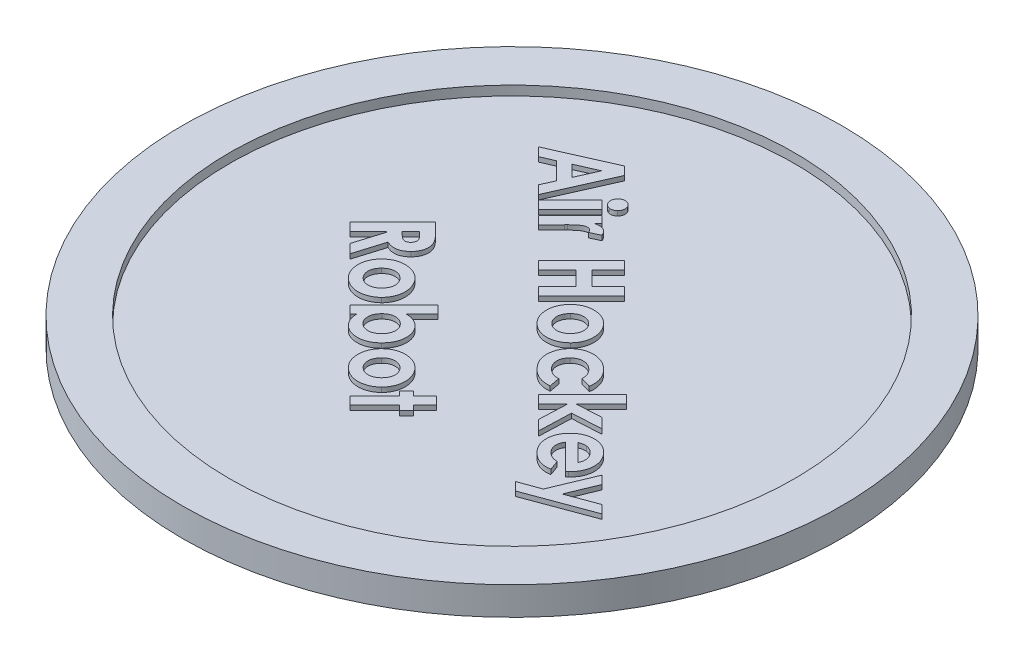
from build123d import *

# Parameters (mm, degrees)
SKETCH_1_R          = 35
EXTRUDE_1_DEPTH     = 3
SKETCH_2_R          = 30
CUT_EXTRUDE_1_DEPTH = 1
EXTRUDE_2_DEPTH     = 0.5


with BuildPart() as part:
    # 草圖1 → 填料-伸長1 (new body)
    with BuildSketch(Plane(origin=(0, 0, 0), x_dir=(1, 0, 0), z_dir=(0, 1, 0))):
        with Locations(Location((0, 0, 0), (0, 0, 270))):
            Circle(SKETCH_1_R)
    extrude(amount=EXTRUDE_1_DEPTH)

    # 草圖2 → 除料-伸長1 (cut)
    with BuildSketch(Plane(origin=(0, 3, 0), x_dir=(1, 0, 0), z_dir=(0, 1, 0))):
        with Locations(Location((0, 0, 0), (0, 0, 270))):
            Circle(SKETCH_2_R)
    extrude(amount=-CUT_EXTRUDE_1_DEPTH, mode=Mode.SUBTRACT)

    # 草圖3 → 填料-伸長2 (add)
    # profile 1 of 15: a face of its own
    with BuildSketch(Plane(origin=(0, 2, 0), x_dir=(1, 0, 0), z_dir=(0, 1, 0))):
        Polygon((-8.308132153, 20.235517611), (-7.429225903, 19.356611361), (-10.228705069, 13.057132194), (-11.128444653, 13.956871777), (-10.546413403, 15.249840527), (-12.401882153, 17.105309277), (-13.710475903, 16.538903027), (-14.611517569, 17.439944694), align=None)
        Polygon((-9.069850903, 18.583173861), (-11.236517569, 17.627444694), (-10.028184236, 16.419111361), align=None, mode=Mode.SUBTRACT)
    # profile 2 of 15: a face of its own
    with BuildSketch(Plane(origin=(0, 2, 0), x_dir=(1, 0, 0), z_dir=(0, 1, 0))):
        with BuildLine():
            add(Edge.make_bspline(
                [(-4.540701528, 16.869128653), (-4.506302538, 16.831415875), (-4.438672262, 16.757270513), (-4.369666269, 16.623185376), (-4.3265856, 16.478719339), (-4.315458453, 16.325713882), (-4.327339772, 16.172301179), (-4.374316337, 16.027041873), (-4.445159914, 15.891071744), (-4.514529993, 15.815249065), (-4.549816111, 15.776680736)],
                knots=[0, 0, 0, 0, 1.005724699, 1.977309142, 2.95252767, 3.969148236, 4.995077585, 5.975270981, 6.970091596, 8, 8, 8, 8], degree=3))
            add(Edge.make_bspline(
                [(-4.549816111, 15.776680736), (-4.587983789, 15.741892176), (-4.66273734, 15.673756816), (-4.79657428, 15.603315447), (-4.940445468, 15.558559849), (-5.092355459, 15.545966332), (-5.243766105, 15.557915221), (-5.387317456, 15.598335129), (-5.518106038, 15.668851651), (-5.591796798, 15.734305428), (-5.629243195, 15.767566153)],
                knots=[0, 0, 0, 0, 1.031019004, 2.019308924, 3.001342932, 4.031921768, 5.053065166, 6.030158479, 6.999013346, 8, 8, 8, 8], degree=3))
            add(Edge.make_bspline(
                [(-5.629243195, 15.767566153), (-5.663901005, 15.806231646), (-5.731566126, 15.881721276), (-5.803929615, 16.015803847), (-5.843927233, 16.162228711), (-5.856431857, 16.315785833), (-5.842050627, 16.47047963), (-5.794973901, 16.616934808), (-5.721684858, 16.753643585), (-5.651867743, 16.830095732), (-5.616222361, 16.869128653)],
                knots=[0, 0, 0, 0, 1.015137644, 1.981931666, 2.954137343, 3.970023233, 4.987475091, 5.977566914, 6.96743944, 8, 8, 8, 8], degree=3))
            add(Edge.make_bspline(
                [(-5.616222361, 16.869128653), (-5.578485152, 16.903476903), (-5.504576056, 16.970748653), (-5.372018276, 17.040034704), (-5.229299597, 17.082926609), (-5.078461945, 17.096326776), (-4.927624292, 17.082926609), (-4.784905613, 17.040034704), (-4.652347833, 16.970748653), (-4.578438738, 16.903476903), (-4.540701528, 16.869128653)],
                knots=[0, 0, 0, 0, 1.021734464, 2.001087806, 2.975106579, 4, 5.024893421, 5.998912194, 6.978265536, 8, 8, 8, 8], degree=3))
        make_face()
    # profile 3 of 15: a face of its own
    with BuildSketch(Plane(origin=(0, 2, 0), x_dir=(1, 0, 0), z_dir=(0, 1, 0))):
        Polygon((-6.349295278, 15.906889069), (-5.502941111, 15.060534903), (-8.867524445, 11.695951569), (-9.713878611, 12.542305736), align=None)
    # profile 4 of 15: a face of its own
    with BuildSketch(Plane(origin=(0, 2, 0), x_dir=(1, 0, 0), z_dir=(0, 1, 0))):
        with BuildLine():
            Line((-4.922699335, 14.480293127), (-4.198741002, 13.756334793))
            Line((-4.198741002, 13.756334793), (-4.621918085, 13.33315771))
            add(Edge.make_bspline(
                [(-4.621918085, 13.33315771), (-4.562041953, 13.353161022), (-4.445764116, 13.392006914), (-4.268354232, 13.419439503), (-4.096583131, 13.426602959), (-3.93085699, 13.404654332), (-3.773544276, 13.362150083), (-3.626338129, 13.298766809), (-3.490576, 13.214371651), (-3.412501635, 13.141804005), (-3.373220169, 13.105293127)],
                knots=[0, 0, 0, 0, 1.126146671, 2.186946502, 3.195634824, 4.188365352, 5.161051018, 6.09895006, 7.043526897, 8, 8, 8, 8], degree=3))
            add(Edge.make_bspline(
                [(-3.373220169, 13.105293127), (-3.346242255, 13.076520363), (-3.291376697, 13.01800458), (-3.225050678, 12.914161811), (-3.163336392, 12.800420587), (-3.132606793, 12.717302305), (-3.116709752, 12.674303543)],
                knots=[0, 0, 0, 0, 0.934144126, 1.899788824, 2.913518474, 4, 4, 4, 4], degree=3))
            Line((-3.116709752, 12.674303543), (-4.106293085, 12.210761877))
            add(Edge.make_bspline(
                [(-4.106293085, 12.210761877), (-4.11892839, 12.245200475), (-4.142737929, 12.310095402), (-4.181990177, 12.399089101), (-4.225842137, 12.472274938), (-4.260683368, 12.511536539), (-4.276866002, 12.529772293)],
                knots=[0, 0, 0, 0, 1.207300046, 2.274995243, 3.198790619, 4, 4, 4, 4], degree=3))
            add(Edge.make_bspline(
                [(-4.276866002, 12.529772293), (-4.293238863, 12.545250309), (-4.325784589, 12.576017275), (-4.384533726, 12.609389694), (-4.447987721, 12.63479308), (-4.517473699, 12.650046414), (-4.592275877, 12.656297153), (-4.672759094, 12.653731141), (-4.75848589, 12.639701526), (-4.851493603, 12.617938112), (-4.952181234, 12.580278882), (-5.061564598, 12.524401745), (-5.181760152, 12.450936445), (-5.311374534, 12.357593758), (-5.45189197, 12.247039654), (-5.601914247, 12.116794675), (-5.762975202, 11.969138416), (-5.871417524, 11.861753353), (-5.927907669, 11.80581396)],
                knots=[0, 0, 0, 0, 0.547554116, 1.088419826, 1.634745323, 2.209833694, 2.815372807, 3.461273872, 4.167714151, 4.930047112, 5.787193072, 6.781080403, 7.920888814, 9.218788771, 10.673267404, 12.279143793, 14.061718902, 16, 16, 16, 16], degree=3))
            Line((-5.927907669, 11.80581396), (-6.089366002, 11.639147293))
            Line((-6.089366002, 11.639147293), (-7.450043085, 10.27847021))
            Line((-7.450043085, 10.27847021), (-8.287282669, 11.115709793))
            Line((-8.287282669, 11.115709793), (-4.922699335, 14.480293127))
        make_face()
    # profile 5 of 15: a face of its own
    with BuildSketch(Plane(origin=(0, 2, 0), x_dir=(1, 0, 0), z_dir=(0, 1, 0))):
        Polygon((0.380118646, 11.547266812), (1.257722813, 10.669662645), (-0.458423021, 8.953516812), (1.063712396, 7.431381395), (2.779858229, 9.147527229), (3.654858229, 8.272527229), (-0.894620937, 3.723048062), (-1.769620937, 4.598048062), (0.225170729, 6.592839729), (-1.296964687, 8.114975145), (-3.291756354, 6.120183479), (-4.169360521, 6.997787645), align=None)
    # profile 6 of 15: a face of its own
    with BuildSketch(Plane(origin=(0, 2, 0), x_dir=(1, 0, 0), z_dir=(0, 1, 0))):
        with BuildLine():
            add(Edge.make_bspline(
                [(5.073611982, 4.658460976), (5.112359931, 4.618159198), (5.189367823, 4.538063218), (5.294508512, 4.409739231), (5.391961361, 4.277098353), (5.477066541, 4.136733679), (5.556146486, 3.992806723), (5.623377751, 3.841629117), (5.683963423, 3.686050946), (5.73241364, 3.524653673), (5.773370585, 3.361510632), (5.801948919, 3.197437219), (5.818788173, 3.033828332), (5.825283364, 2.870747878), (5.821742897, 2.708025391), (5.806012455, 2.545691545), (5.778113631, 2.384047665), (5.740998025, 2.22338796), (5.692320164, 2.065761129), (5.635499097, 1.912492212), (5.569081339, 1.764243092), (5.491093454, 1.622639845), (5.407556423, 1.483884891), (5.311537007, 1.352058224), (5.206222312, 1.225898514), (5.130065998, 1.146320123), (5.091841148, 1.106377643)],
                knots=[0, 0, 0, 0, 1.019077246, 2.025319838, 3.022652611, 4.017627434, 5.016246866, 6.01511716, 7.032225648, 8.058652104, 9.085597134, 10.097890734, 11.092519255, 12.082603187, 13.072180877, 14.058144064, 15.053496535, 16.061356281, 17.062763015, 18.059467547, 19.040654524, 20.021586116, 21.005673426, 21.991954205, 22.99210918, 24, 24, 24, 24], degree=3))
            add(Edge.make_bspline(
                [(5.091841148, 1.106377643), (5.052095312, 1.067491064), (4.973078049, 0.990182057), (4.843973057, 0.886869464), (4.711993138, 0.789725272), (4.57311717, 0.703957948), (4.429407862, 0.626502177), (4.279574246, 0.559075051), (4.124331148, 0.500368571), (3.964780714, 0.451093265), (3.802646164, 0.411789969), (3.639814028, 0.385014622), (3.477670334, 0.367117051), (3.315822841, 0.363132637), (3.153908594, 0.365504356), (2.992182562, 0.383603654), (2.830851313, 0.41075414), (2.670493894, 0.448068206), (2.513417476, 0.498093851), (2.359887991, 0.556565673), (2.210258193, 0.623697917), (2.067787586, 0.704681604), (1.92696431, 0.790810365), (1.793572213, 0.891146661), (1.662713406, 0.998382837), (1.580913211, 1.07715991), (1.539757815, 1.11679431)],
                knots=[0, 0, 0, 0, 1.011697538, 2.011319398, 3.007061161, 3.993732213, 4.98005516, 5.977331991, 6.982621712, 7.999858455, 9.01562103, 10.017177301, 11.002360137, 11.982682706, 12.962782332, 13.947965168, 14.941729788, 15.940289251, 16.942437578, 17.940340289, 18.930422597, 19.924312866, 20.921871392, 21.933322039, 22.960210896, 24, 24, 24, 24], degree=3))
            add(Edge.make_bspline(
                [(1.539757815, 1.11679431), (1.482080223, 1.177783262), (1.368354103, 1.298038574), (1.221395342, 1.494996848), (1.0947087, 1.699356046), (0.994606542, 1.91547809), (0.914175308, 2.139614702), (0.858732018, 2.374215261), (0.824364155, 2.617435361), (0.81504093, 2.86726372), (0.82569953, 3.117055252), (0.860990437, 3.361382417), (0.920015867, 3.596307704), (1.000313968, 3.822834239), (1.106157376, 4.038956102), (1.232778725, 4.246870574), (1.382831239, 4.446293044), (1.498986309, 4.56799629), (1.557986982, 4.629815143)],
                knots=[0, 0, 0, 0, 1.029931388, 2.030773055, 3.011491503, 3.977033508, 4.949609453, 5.930689829, 6.931574062, 7.961008964, 8.996001876, 9.997637795, 10.986431696, 11.965817094, 12.943054205, 13.935646626, 14.951416964, 16, 16, 16, 16], degree=3))
            add(Edge.make_bspline(
                [(1.557986982, 4.629815143), (1.624003516, 4.692476072), (1.753977642, 4.815843642), (1.967888137, 4.973176541), (2.190334291, 5.106191952), (2.422950558, 5.212440052), (2.666164783, 5.290488248), (2.918579084, 5.34449163), (3.18156384, 5.37097779), (3.359594457, 5.367338523), (3.449914065, 5.365492226)],
                knots=[0, 0, 0, 0, 1.042716123, 2.052911692, 3.036918457, 4.01009467, 4.977912503, 5.959765238, 6.964935325, 8, 8, 8, 8], degree=3))
            add(Edge.make_bspline(
                [(3.449914065, 5.365492226), (3.529064158, 5.35948099), (3.68474366, 5.34765755), (3.912727535, 5.306624485), (4.131220448, 5.246855735), (4.339895992, 5.167080842), (4.539423958, 5.069032083), (4.728239136, 4.951174762), (4.908622074, 4.815537342), (5.018170914, 4.71124288), (5.073611982, 4.658460976)],
                knots=[0, 0, 0, 0, 1.050238507, 2.065703277, 3.060941432, 4.044770367, 5.018616752, 5.999151908, 6.98740001, 8, 8, 8, 8], degree=3))
        make_face()
        with BuildLine():
            add(Edge.make_bspline(
                [(4.291059898, 3.849867226), (4.258276635, 3.881416242), (4.19375478, 3.943508932), (4.087545005, 4.022623085), (3.977875265, 4.089777852), (3.863337117, 4.143484583), (3.744812416, 4.185441519), (3.621250564, 4.214277124), (3.493338488, 4.229818373), (3.362525112, 4.231870626), (3.231281555, 4.223173822), (3.101824449, 4.201505192), (2.97659955, 4.16411302), (2.854310656, 4.115840613), (2.735399317, 4.054060733), (2.619425618, 3.979647878), (2.506724952, 3.892264855), (2.437170955, 3.82535858), (2.401736982, 3.791273476)],
                knots=[0, 0, 0, 0, 1.03096956, 2.029086276, 2.996391749, 3.943093968, 4.892606537, 5.842884122, 6.814736472, 7.809108808, 8.805671127, 9.794424805, 10.778758902, 11.763978501, 12.772140384, 13.812465576, 14.885570338, 16, 16, 16, 16], degree=3))
            add(Edge.make_bspline(
                [(2.401736982, 3.791273476), (2.366758819, 3.75498775), (2.2980737, 3.683735024), (2.208701658, 3.568500377), (2.130816157, 3.451577481), (2.068594178, 3.33051563), (2.016685119, 3.208264475), (1.980273563, 3.081861315), (1.956743898, 2.952717454), (1.946647141, 2.821865685), (1.948427656, 2.69172377), (1.966345357, 2.564973489), (1.994093926, 2.44197784), (2.03724421, 2.323904532), (2.08961754, 2.208509356), (2.158499477, 2.09946641), (2.238491164, 1.993795755), (2.299962292, 1.928738028), (2.331424482, 1.895440143)],
                knots=[0, 0, 0, 0, 1.135685708, 2.230097347, 3.283299858, 4.29886171, 5.294853694, 6.273529507, 7.258303048, 8.249861526, 9.228733054, 10.186536227, 11.131351297, 12.066178827, 13.016301177, 13.983161557, 14.967740556, 16, 16, 16, 16], degree=3))
            add(Edge.make_bspline(
                [(2.331424482, 1.895440143), (2.364667981, 1.863906941), (2.429870653, 1.802058789), (2.536623879, 1.722905559), (2.645777921, 1.653651454), (2.761851931, 1.600653432), (2.881180245, 1.558628699), (3.00524883, 1.530120333), (3.133361499, 1.512466821), (3.26524397, 1.510532515), (3.397231826, 1.521113186), (3.527534831, 1.542637188), (3.654332909, 1.579796141), (3.777880247, 1.629582808), (3.898997312, 1.69061114), (4.014879494, 1.767519839), (4.128834896, 1.855567119), (4.199219833, 1.923393075), (4.235070315, 1.957940143)],
                knots=[0, 0, 0, 0, 1.030150722, 2.020502673, 2.98538793, 3.93356935, 4.884914481, 5.827799461, 6.793327102, 7.789728672, 8.788998142, 9.770059894, 10.756116334, 11.755433532, 12.764440154, 13.801972256, 14.88043724, 16, 16, 16, 16], degree=3))
            add(Edge.make_bspline(
                [(4.235070315, 1.957940143), (4.26960586, 1.993797132), (4.337409192, 2.064194843), (4.425619317, 2.178058298), (4.501840094, 2.294116406), (4.564537848, 2.413152356), (4.615248305, 2.534860923), (4.649374035, 2.66066252), (4.67414721, 2.788575462), (4.681863542, 2.918741677), (4.680702312, 3.048367141), (4.662576887, 3.175117154), (4.634934811, 3.298704798), (4.590712734, 3.417246316), (4.536522072, 3.532552297), (4.467435051, 3.643091638), (4.385572082, 3.749675014), (4.322909692, 3.816103312), (4.291059898, 3.849867226)],
                knots=[0, 0, 0, 0, 1.123779765, 2.206306951, 3.247747078, 4.256370284, 5.241273741, 6.218929401, 7.1957491, 8.17850339, 9.159054796, 10.118501691, 11.064938192, 12.013910021, 12.969844468, 13.938364113, 14.952119812, 16, 16, 16, 16], degree=3))
        make_face(mode=Mode.SUBTRACT)
    # profile 7 of 15: a face of its own
    with BuildSketch(Plane(origin=(0, 2, 0), x_dir=(1, 0, 0), z_dir=(0, 1, 0))):
        with BuildLine():
            Line((10.086090557, -1.887871765), (8.99754889, -1.572767599))
            add(Edge.make_bspline(
                [(8.99754889, -1.572767599), (8.997882731, -1.508053506), (8.998525096, -1.383532706), (8.980202627, -1.204693618), (8.947324502, -1.041925042), (8.896393493, -0.89405258), (8.829747288, -0.754929925), (8.743615025, -0.621383454), (8.642516409, -0.486972344), (8.562319225, -0.404391466), (8.52098639, -0.361830099)],
                knots=[0, 0, 0, 0, 1.15413121, 2.220742607, 3.202025827, 4.110720337, 5.004471644, 5.947791409, 6.942312015, 8, 8, 8, 8], degree=3))
            add(Edge.make_bspline(
                [(8.52098639, -0.361830099), (8.481625787, -0.324300333), (8.404230227, -0.250504788), (8.280772745, -0.152919089), (8.153770302, -0.070365769), (8.024060273, -0.001968455), (7.890817462, 0.052323236), (7.753278778, 0.089136795), (7.613558802, 0.115219875), (7.471620628, 0.12292764), (7.330613798, 0.120550845), (7.192522585, 0.099652273), (7.058243292, 0.067973862), (6.928272338, 0.02031417), (6.802592877, -0.041227199), (6.681700673, -0.117188025), (6.563936883, -0.206466437), (6.491679647, -0.275569044), (6.45458014, -0.311048849)],
                knots=[0, 0, 0, 0, 1.123577633, 2.209313703, 3.246844627, 4.249951721, 5.236069482, 6.213211358, 7.188044763, 8.167818233, 9.145947786, 10.097388463, 11.04815232, 11.993101052, 12.951913267, 13.935089094, 14.939799237, 16, 16, 16, 16], degree=3))
            add(Edge.make_bspline(
                [(6.45458014, -0.311048849), (6.420512388, -0.346934438), (6.353615447, -0.417400963), (6.266068281, -0.531012804), (6.192799165, -0.64900427), (6.132221663, -0.770347562), (6.08629311, -0.896129268), (6.055173683, -1.025958106), (6.036977448, -1.159426793), (6.031578367, -1.295521035), (6.040702855, -1.43213837), (6.064069375, -1.566631838), (6.102233079, -1.698005949), (6.154996255, -1.825873465), (6.220314315, -1.95167835), (6.300052489, -2.074228654), (6.394396641, -2.193109641), (6.465272882, -2.267741181), (6.50145514, -2.305840515)],
                knots=[0, 0, 0, 0, 1.058346643, 2.078216131, 3.062709567, 4.026347698, 4.975373472, 5.921486162, 6.877710718, 7.853623855, 8.830994338, 9.80212269, 10.769156441, 11.752246964, 12.757549182, 13.798307538, 14.876037951, 16, 16, 16, 16], degree=3))
            add(Edge.make_bspline(
                [(6.50145514, -2.305840515), (6.548338499, -2.350659093), (6.640053688, -2.43833507), (6.789049096, -2.550398146), (6.942298544, -2.642409825), (7.09943043, -2.714734087), (7.261060264, -2.767469979), (7.427114983, -2.80021734), (7.597800493, -2.81246545), (7.711981701, -2.804604693), (7.769684307, -2.800632182)],
                knots=[0, 0, 0, 0, 1.103422607, 2.158561471, 3.165974868, 4.141337476, 5.097022321, 6.053420992, 7.016276989, 8, 8, 8, 8], degree=3))
            Line((7.769684307, -2.800632182), (7.980621807, -3.920423849))
            add(Edge.make_bspline(
                [(7.980621807, -3.920423849), (7.878289119, -3.930443592), (7.676801464, -3.950171938), (7.375358039, -3.933821801), (7.082409136, -3.884869377), (6.797112678, -3.799348526), (6.520477597, -3.676962903), (6.25295589, -3.51782496), (5.992470685, -3.323858196), (5.832394835, -3.171749463), (5.750153057, -3.093600932)],
                knots=[0, 0, 0, 0, 0.998027156, 1.965062747, 2.923393704, 3.878879977, 4.851492478, 5.855571275, 6.8982621, 8, 8, 8, 8], degree=3))
            add(Edge.make_bspline(
                [(5.750153057, -3.093600932), (5.679905913, -3.020046265), (5.542820732, -2.876506553), (5.362488647, -2.647585622), (5.209977616, -2.41456181), (5.088862746, -2.175470893), (4.991573832, -1.933968537), (4.926605288, -1.686288228), (4.889993054, -1.434263488), (4.881075297, -1.180166431), (4.898811034, -0.929209351), (4.936203732, -0.686020584), (4.994439078, -0.452808877), (5.076251078, -0.23035072), (5.177548106, -0.016873857), (5.302505395, 0.185266346), (5.446902078, 0.378322273), (5.558384505, 0.4955703), (5.61473639, 0.554836568)],
                knots=[0, 0, 0, 0, 1.192958301, 2.328022118, 3.414370075, 4.455309373, 5.468223845, 6.463924045, 7.452132411, 8.451005793, 9.441272533, 10.400024009, 11.335107751, 12.256709812, 13.177030354, 14.10292869, 15.041072681, 16, 16, 16, 16], degree=3))
            add(Edge.make_bspline(
                [(5.61473639, 0.554836568), (5.655831869, 0.59454137), (5.73731423, 0.673266358), (5.868613724, 0.779161055), (6.002250436, 0.87846974), (6.143955992, 0.963752083), (6.289974301, 1.040802331), (6.440478374, 1.108917058), (6.59707201, 1.164849408), (6.757502412, 1.211473857), (6.921374857, 1.24817805), (7.086736117, 1.272833739), (7.252503668, 1.28597458), (7.418710446, 1.287205223), (7.585380098, 1.276909269), (7.752240552, 1.254118517), (7.920032707, 1.222187127), (8.087085037, 1.175836774), (8.253108232, 1.1207799), (8.415457548, 1.053458615), (8.574034552, 0.977118359), (8.728674877, 0.889544276), (8.877749454, 0.789884205), (9.024579302, 0.682319753), (9.165361897, 0.561513499), (9.255341723, 0.474983311), (9.300934307, 0.431138651)],
                knots=[0, 0, 0, 0, 0.998546862, 1.979876108, 2.946722394, 3.907174954, 4.867777385, 5.83241755, 6.792570297, 7.772372729, 8.751822482, 9.72626223, 10.692959612, 11.656703965, 12.629901973, 13.609733789, 14.599389313, 15.6136704, 16.638316116, 17.655743147, 18.684091197, 19.71378225, 20.759785157, 21.817612011, 22.894188707, 24, 24, 24, 24], degree=3))
            add(Edge.make_bspline(
                [(9.300934307, 0.431138651), (9.341870541, 0.389564042), (9.422787684, 0.307385046), (9.532881242, 0.17633228), (9.635198348, 0.043390013), (9.727607841, -0.093019213), (9.80971518, -0.232891536), (9.882823861, -0.375008502), (9.947089442, -0.520110845), (10.019178397, -0.716585119), (10.087430724, -0.966387277), (10.126959672, -1.272315613), (10.1323799, -1.581171938), (10.101580003, -1.785243165), (10.086090557, -1.887871765)],
                knots=[0, 0, 0, 0, 0.823435261, 1.627654116, 2.414479976, 3.191171413, 3.952038252, 4.702945379, 5.446440362, 6.190894271, 7.656481361, 9.090733376, 10.536912984, 12, 12, 12, 12], degree=3))
        make_face()
    # profile 8 of 15: a face of its own
    with BuildSketch(Plane(origin=(0, 2, 0), x_dir=(1, 0, 0), z_dir=(0, 1, 0))):
        Polygon((12.844662882, -0.688110757), (13.688412882, -1.531860757), (11.000912882, -4.219360757), (13.632423299, -4.074829507), (14.689714965, -5.132121174), (11.627214965, -5.298787841), (11.500912882, -8.672485757), (10.452735799, -7.624308674), (10.573829549, -4.646444091), (9.024350382, -6.195923257), (8.180600382, -5.352173257), align=None)
    # profile 9 of 15: a face of its own
    with BuildSketch(Plane(origin=(0, 2, 0), x_dir=(1, 0, 0), z_dir=(0, 1, 0))):
        with BuildLine():
            Line((16.694994316, -10.991567192), (13.982754733, -8.279327608))
            add(Edge.make_bspline(
                [(13.982754733, -8.279327608), (13.959337255, -8.314217317), (13.913384904, -8.382681741), (13.852519123, -8.488452359), (13.803810828, -8.597012089), (13.768425194, -8.707903978), (13.739553823, -8.819344492), (13.724615983, -8.932970473), (13.719341415, -9.047972447), (13.724238792, -9.1640036), (13.741404892, -9.279494126), (13.768996957, -9.393155157), (13.806174398, -9.505045337), (13.858612978, -9.612744783), (13.918132648, -9.720596429), (13.989824738, -9.825429715), (14.072602034, -9.928164945), (14.134582012, -9.992465518), (14.166348483, -10.025421358)],
                knots=[0, 0, 0, 0, 1.045450187, 2.051497366, 3.032953714, 3.999500088, 4.945122935, 5.893640144, 6.84504291, 7.807234905, 8.778656626, 9.745263339, 10.715243067, 11.705690765, 12.721143425, 13.778574969, 14.861457606, 16, 16, 16, 16], degree=3))
            add(Edge.make_bspline(
                [(14.166348483, -10.025421358), (14.206004255, -10.063129831), (14.284311306, -10.137591611), (14.412936464, -10.234009841), (14.547268216, -10.316329563), (14.687585298, -10.384576211), (14.833964891, -10.438734453), (14.987517998, -10.475415048), (15.146370539, -10.501721322), (15.254781055, -10.505355354), (15.30957765, -10.507192192)],
                knots=[0, 0, 0, 0, 1.030638927, 2.035171502, 3.022842558, 3.996010081, 4.971649843, 5.957693539, 6.967706782, 8, 8, 8, 8], degree=3))
            Line((15.30957765, -10.507192192), (15.687181816, -11.554067192))
            add(Edge.make_bspline(
                [(15.687181816, -11.554067192), (15.633888457, -11.562607378), (15.528971211, -11.579420219), (15.371862869, -11.591800639), (15.217988415, -11.595992553), (15.066645495, -11.590835569), (14.917952641, -11.576387225), (14.77199795, -11.553592818), (14.629572806, -11.51892158), (14.489571634, -11.476489397), (14.352333865, -11.421782536), (14.21553321, -11.360230703), (14.081362853, -11.28635589), (13.947851871, -11.203943035), (13.81517336, -11.112023593), (13.68478655, -11.007910715), (13.554686941, -10.895606698), (13.471477358, -10.814075759), (13.429369316, -10.772817192)],
                knots=[0, 0, 0, 0, 1.037977262, 2.043438746, 3.029045694, 3.998210143, 4.954520143, 5.901709836, 6.837383455, 7.772348922, 8.713557472, 9.677564548, 10.656499443, 11.657548015, 12.695256563, 13.75936974, 14.866133574, 16, 16, 16, 16], degree=3))
            add(Edge.make_bspline(
                [(13.429369316, -10.772817192), (13.366528254, -10.707047403), (13.242961147, -10.577721415), (13.081774328, -10.369151698), (12.945327066, -10.154040313), (12.832028336, -9.933660803), (12.745694687, -9.705514341), (12.684643778, -9.47103163), (12.645788634, -9.230350508), (12.635556796, -8.985056255), (12.645866294, -8.74069035), (12.68367818, -8.501945231), (12.741248107, -8.270130777), (12.825971393, -8.046896409), (12.931659464, -7.830672932), (13.061598078, -7.622560772), (13.215605196, -7.422735286), (13.333173816, -7.29915207), (13.392910983, -7.236358858)],
                knots=[0, 0, 0, 0, 1.100745336, 2.164443293, 3.184897046, 4.181323548, 5.159218785, 6.131705848, 7.11051835, 8.104794882, 9.099071413, 10.066690958, 11.026373306, 11.985811056, 12.951688299, 13.9359163, 14.9512294, 16, 16, 16, 16], degree=3))
            add(Edge.make_bspline(
                [(13.392910983, -7.236358858), (13.457330062, -7.174746086), (13.583524803, -7.054048802), (13.789010812, -6.897542902), (13.999517048, -6.762341107), (14.218694628, -6.652181469), (14.445095591, -6.565842939), (14.679261646, -6.502502721), (14.921237162, -6.465867272), (15.167469153, -6.44947297), (15.413455618, -6.458927938), (15.653908907, -6.490980797), (15.886342809, -6.547776444), (16.111188506, -6.62675351), (16.327169736, -6.732275865), (16.534868346, -6.860844244), (16.735965263, -7.012037002), (16.858899542, -7.129576302), (16.921556816, -7.189483858)],
                knots=[0, 0, 0, 0, 1.08329914, 2.122145429, 3.135427435, 4.12213039, 5.099471087, 6.077666602, 7.066076352, 8.07095118, 9.074508194, 10.054638534, 11.016071497, 11.979342807, 12.947230691, 13.933086206, 14.946533169, 16, 16, 16, 16], degree=3))
            add(Edge.make_bspline(
                [(16.921556816, -7.189483858), (16.984924551, -7.255611818), (17.108933371, -7.385022319), (17.269747338, -7.595278953), (17.405531731, -7.811620419), (17.517630094, -8.034541309), (17.603947605, -8.264064021), (17.664155713, -8.500770367), (17.699713869, -8.743845808), (17.707957645, -8.991723395), (17.693187826, -9.240080253), (17.650750728, -9.484757461), (17.58436491, -9.724551919), (17.490958129, -9.958716676), (17.372084553, -10.187447808), (17.225501633, -10.40963827), (17.055562933, -10.627767368), (16.925413492, -10.763506465), (16.859056816, -10.832713025)],
                knots=[0, 0, 0, 0, 1.071714939, 2.097315058, 3.092797047, 4.058692489, 5.013927649, 5.958067696, 6.913208226, 7.884502939, 8.857059808, 9.821188954, 10.786616375, 11.765222125, 12.767606943, 13.799383012, 14.878015722, 16, 16, 16, 16], degree=3))
            Line((16.859056816, -10.832713025), (16.694994316, -10.991567192))
        make_face()
        with BuildLine():
            add(Edge.make_bspline(
                [(16.51270265, -9.478546358), (16.542178326, -9.41732395), (16.600476631, -9.296235546), (16.650379923, -9.09981234), (16.663820984, -8.896766777), (16.645301473, -8.689904129), (16.595251233, -8.485295984), (16.511715728, -8.289727852), (16.396541115, -8.106234601), (16.297521019, -7.99921216), (16.24707765, -7.944692192)],
                knots=[0, 0, 0, 0, 0.975106788, 1.928609598, 2.892045738, 3.888073122, 4.903613331, 5.907351708, 6.93395145, 8, 8, 8, 8], degree=3))
            add(Edge.make_bspline(
                [(16.24707765, -7.944692192), (16.217508467, -7.916496389), (16.15889048, -7.860600992), (16.06560981, -7.78523643), (15.968057612, -7.719757936), (15.867886489, -7.662016594), (15.763638395, -7.613873272), (15.655901495, -7.574984757), (15.545304906, -7.542434408), (15.469042651, -7.530249896), (15.4306714, -7.524119275)],
                knots=[0, 0, 0, 0, 1.048913515, 2.07936753, 3.07474758, 4.063177134, 5.045555794, 6.018723756, 7.003123513, 8, 8, 8, 8], degree=3))
            add(Edge.make_bspline(
                [(15.4306714, -7.524119275), (15.378588645, -7.519298034), (15.267698534, -7.509033063), (15.089635002, -7.531485456), (14.892264865, -7.577607084), (14.756651654, -7.625152512), (14.68457765, -7.650421358)],
                knots=[0, 0, 0, 0, 0.819449328, 1.744700851, 2.801381962, 4, 4, 4, 4], degree=3))
            Line((14.68457765, -7.650421358), (16.51270265, -9.478546358))
        make_face(mode=Mode.SUBTRACT)
    # profile 10 of 15: a face of its own
    with BuildSketch(Plane(origin=(0, 2, 0), x_dir=(1, 0, 0), z_dir=(0, 1, 0))):
        Polygon((18.941847892, -9.3842541), (19.805129142, -10.24753535), (18.568149975, -13.234514517), (21.644972892, -12.0873791), (22.510858308, -12.953264517), (15.806431225, -15.4389416), (14.935337475, -14.56784785), (17.108514558, -13.780087434), align=None)
    # profile 11 of 15: a face of its own
    with BuildSketch(Plane(origin=(0, 2, 0), x_dir=(1, 0, 0), z_dir=(0, 1, 0))):
        with BuildLine():
            Line((-13.165694316, 5.058387641), (-12.246423483, 4.139116808))
            add(Edge.make_bspline(
                [(-12.246423483, 4.139116808), (-12.186142326, 4.078288777), (-12.07007867, 3.961172188), (-11.908667325, 3.78611222), (-11.763637563, 3.621403335), (-11.637454347, 3.465287726), (-11.528116705, 3.318936165), (-11.437193151, 3.181610455), (-11.362870774, 3.053866461), (-11.290368005, 2.896345397), (-11.227396427, 2.701258063), (-11.18999687, 2.460829962), (-11.193619321, 2.213843162), (-11.227838041, 2.006771572), (-11.272220744, 1.841112026), (-11.316483615, 1.717990924), (-11.370309072, 1.597594519), (-11.433137561, 1.47951791), (-11.506283413, 1.364122211), (-11.588001407, 1.25030497), (-11.681432733, 1.140803447), (-11.748673745, 1.070643292), (-11.782881816, 1.034950141)],
                knots=[0, 0, 0, 0, 1.422202288, 2.738268528, 3.954141481, 5.066430475, 6.071316919, 6.98699961, 7.800638646, 8.52311233, 9.863551151, 11.190939953, 12.546221376, 13.948184307, 14.665134715, 15.392482769, 16.118543733, 16.853814389, 17.6118083, 18.386113774, 19.178954413, 20, 20, 20, 20], degree=3))
            add(Edge.make_bspline(
                [(-11.782881816, 1.034950141), (-11.820099503, 0.99875076), (-11.893151216, 0.927697801), (-12.010004092, 0.833400494), (-12.126440056, 0.747269694), (-12.247889955, 0.676289384), (-12.36912291, 0.612743887), (-12.494290654, 0.563527049), (-12.620344322, 0.524013627), (-12.748911724, 0.496500169), (-12.87923678, 0.480791934), (-13.012096946, 0.47740094), (-13.147129178, 0.48348862), (-13.284687679, 0.502231241), (-13.424073047, 0.532019822), (-13.56536787, 0.57500062), (-13.709950938, 0.625948716), (-13.804885061, 0.669193903), (-13.853194316, 0.691200141)],
                knots=[0, 0, 0, 0, 1.101479092, 2.162007974, 3.184848731, 4.17239096, 5.144818291, 6.087504516, 7.022959366, 7.946358646, 8.874297119, 9.805249426, 10.764537915, 11.740494148, 12.748833498, 13.786627476, 14.87367812, 16, 16, 16, 16], degree=3))
            Line((-13.853194316, 0.691200141), (-14.798506816, -2.407758192))
            Line((-14.798506816, -2.407758192), (-15.7451214, -1.461143609))
            Line((-15.7451214, -1.461143609), (-14.841475566, 1.489377224))
            Line((-14.841475566, 1.489377224), (-14.922204733, 1.570106391))
            Line((-14.922204733, 1.570106391), (-16.849288066, -0.356976942))
            Line((-16.849288066, -0.356976942), (-17.715173483, 0.508908474))
            Line((-17.715173483, 0.508908474), (-13.165694316, 5.058387641))
        make_face()
        with BuildLine():
            Line((-14.078454733, 2.413856391), (-13.806319316, 2.141720974))
            add(Edge.make_bspline(
                [(-13.806319316, 2.141720974), (-13.77274101, 2.108873997), (-13.708393247, 2.045927717), (-13.611464517, 1.960059602), (-13.520714964, 1.883783461), (-13.433467163, 1.819527583), (-13.350490732, 1.767828844), (-13.273132847, 1.726010403), (-13.199560953, 1.697204276), (-13.108953132, 1.672233713), (-12.994717407, 1.667847776), (-12.86071619, 1.702806154), (-12.729208689, 1.774711609), (-12.652939114, 1.845105998), (-12.6123089, 1.882606391)],
                knots=[0, 0, 0, 0, 1.201236092, 2.301987891, 3.311156246, 4.232619625, 5.070444904, 5.810318871, 6.478236266, 7.086778476, 8.208874868, 9.353156532, 10.589977522, 12, 12, 12, 12], degree=3))
            add(Edge.make_bspline(
                [(-12.6123089, 1.882606391), (-12.589518208, 1.907668077), (-12.545005486, 1.9566163), (-12.490473435, 2.037936061), (-12.452329395, 2.125362537), (-12.42905644, 2.216438239), (-12.419842351, 2.309519545), (-12.424846534, 2.402294878), (-12.445333461, 2.493845018), (-12.473150839, 2.569603497), (-12.506745913, 2.631667138), (-12.538679118, 2.685022634), (-12.581262617, 2.741977139), (-12.631203532, 2.804548835), (-12.687681296, 2.873835496), (-12.755331365, 2.94617255), (-12.828487734, 3.025747472), (-12.88163915, 3.078978643), (-12.9091839, 3.106564724)],
                knots=[0, 0, 0, 0, 1.128447796, 2.203982445, 3.247103288, 4.292930286, 5.325256976, 6.354231782, 7.375957681, 8.442892605, 9.031898334, 9.726743301, 10.513977804, 11.399823452, 12.396550797, 13.492525903, 14.700547375, 16, 16, 16, 16], degree=3))
            Line((-12.9091839, 3.106564724), (-13.14746515, 3.344845974))
            Line((-13.14746515, 3.344845974), (-14.078454733, 2.413856391))
        make_face(mode=Mode.SUBTRACT)
    # profile 12 of 15: a face of its own
    with BuildSketch(Plane(origin=(0, 2, 0), x_dir=(1, 0, 0), z_dir=(0, 1, 0))):
        with BuildLine():
            add(Edge.make_bspline(
                [(-9.122654549, -1.179964627), (-9.083906599, -1.220266405), (-9.006898707, -1.300362385), (-8.901758018, -1.428686372), (-8.804305169, -1.56132725), (-8.719199989, -1.701691925), (-8.640120045, -1.845618881), (-8.57288878, -1.996796487), (-8.512303107, -2.152374658), (-8.46385289, -2.313771931), (-8.422895945, -2.476914972), (-8.394317611, -2.640988384), (-8.377478357, -2.804597272), (-8.370983166, -2.967677725), (-8.374523633, -3.130400213), (-8.390254075, -3.292734059), (-8.418152899, -3.454377939), (-8.455268505, -3.615037644), (-8.503946366, -3.772664474), (-8.560767433, -3.925933391), (-8.627185191, -4.074182512), (-8.705173076, -4.215785758), (-8.788710107, -4.354540713), (-8.884729524, -4.48636738), (-8.990044218, -4.612527089), (-9.066200532, -4.69210548), (-9.104425382, -4.73204796)],
                knots=[0, 0, 0, 0, 1.019077246, 2.025319838, 3.022652611, 4.017627434, 5.016246866, 6.01511716, 7.032225648, 8.058652104, 9.085597134, 10.097890734, 11.092519255, 12.082603187, 13.072180877, 14.058144064, 15.053496535, 16.061356281, 17.062763015, 18.059467547, 19.040654524, 20.021586116, 21.005673426, 21.991954205, 22.99210918, 24, 24, 24, 24], degree=3))
            add(Edge.make_bspline(
                [(-9.104425382, -4.73204796), (-9.144171218, -4.77093454), (-9.223188481, -4.848243546), (-9.352293473, -4.951556139), (-9.484273392, -5.048700332), (-9.623149361, -5.134467656), (-9.766858669, -5.211923427), (-9.916692284, -5.279350552), (-10.071935382, -5.338057032), (-10.231485816, -5.387332339), (-10.393620367, -5.426635635), (-10.556452503, -5.453410982), (-10.718596196, -5.471308552), (-10.88044369, -5.475292967), (-11.042357936, -5.472921248), (-11.204083968, -5.45482195), (-11.365415217, -5.427671463), (-11.525772636, -5.390357398), (-11.682849054, -5.340331752), (-11.83637854, -5.281859931), (-11.986008337, -5.214727686), (-12.128478944, -5.133744), (-12.26930222, -5.047615238), (-12.402694317, -4.947278943), (-12.533553125, -4.840042766), (-12.615353319, -4.761265694), (-12.656508715, -4.721631294)],
                knots=[0, 0, 0, 0, 1.011697538, 2.011319398, 3.007061161, 3.993732213, 4.98005516, 5.977331991, 6.982621712, 7.999858455, 9.01562103, 10.017177301, 11.002360137, 11.982682706, 12.962782332, 13.947965168, 14.941729788, 15.940289251, 16.942437578, 17.940340289, 18.930422597, 19.924312866, 20.921871392, 21.933322039, 22.960210896, 24, 24, 24, 24], degree=3))
            add(Edge.make_bspline(
                [(-12.656508715, -4.721631294), (-12.714186307, -4.660642342), (-12.827912427, -4.54038703), (-12.974871188, -4.343428756), (-13.10155783, -4.139069558), (-13.201659988, -3.922947513), (-13.282091222, -3.698810902), (-13.337534512, -3.464210343), (-13.371902375, -3.220990242), (-13.3812256, -2.971161883), (-13.370567001, -2.721370351), (-13.335276093, -2.477043187), (-13.276250663, -2.242117899), (-13.195952562, -2.015591364), (-13.090109154, -1.799469502), (-12.963487805, -1.59155503), (-12.813435291, -1.392132559), (-12.697280221, -1.270429314), (-12.638279549, -1.20861046)],
                knots=[0, 0, 0, 0, 1.029931388, 2.030773055, 3.011491503, 3.977033508, 4.949609453, 5.930689829, 6.931574062, 7.961008964, 8.996001876, 9.997637795, 10.986431696, 11.965817094, 12.943054205, 13.935646626, 14.951416964, 16, 16, 16, 16], degree=3))
            add(Edge.make_bspline(
                [(-12.638279549, -1.20861046), (-12.572263014, -1.145949531), (-12.442288888, -1.022581962), (-12.228378393, -0.865249062), (-12.005932239, -0.732233652), (-11.773315973, -0.625985552), (-11.530101748, -0.547937356), (-11.277687446, -0.493933973), (-11.01470269, -0.467447813), (-10.836672073, -0.471087081), (-10.746352465, -0.472933377)],
                knots=[0, 0, 0, 0, 1.042716123, 2.052911692, 3.036918457, 4.01009467, 4.977912503, 5.959765238, 6.964935325, 8, 8, 8, 8], degree=3))
            add(Edge.make_bspline(
                [(-10.746352465, -0.472933377), (-10.667202372, -0.478944614), (-10.51152287, -0.490768054), (-10.283538995, -0.531801119), (-10.065046082, -0.591569869), (-9.856370538, -0.671344762), (-9.656842572, -0.769393521), (-9.468027394, -0.887250842), (-9.287644456, -1.022888262), (-9.178095616, -1.127182724), (-9.122654549, -1.179964627)],
                knots=[0, 0, 0, 0, 1.050238507, 2.065703277, 3.060941432, 4.044770367, 5.018616752, 5.999151908, 6.98740001, 8, 8, 8, 8], degree=3))
        make_face()
        with BuildLine():
            add(Edge.make_bspline(
                [(-9.905206632, -1.988558377), (-9.937989895, -1.957009362), (-10.00251175, -1.894916671), (-10.108721525, -1.815802518), (-10.218391265, -1.748647751), (-10.332929413, -1.69494102), (-10.451454114, -1.652984085), (-10.575015966, -1.62414848), (-10.702928043, -1.60860723), (-10.833741418, -1.606554977), (-10.964984975, -1.615251782), (-11.094442081, -1.636920411), (-11.21966698, -1.674312584), (-11.341955874, -1.722584991), (-11.460867213, -1.784364871), (-11.576840912, -1.858777725), (-11.689541578, -1.946160749), (-11.759095575, -2.013067024), (-11.794529549, -2.047152127)],
                knots=[0, 0, 0, 0, 1.03096956, 2.029086276, 2.996391749, 3.943093968, 4.892606537, 5.842884122, 6.814736472, 7.809108808, 8.805671127, 9.794424805, 10.778758902, 11.763978501, 12.772140384, 13.812465576, 14.885570338, 16, 16, 16, 16], degree=3))
            add(Edge.make_bspline(
                [(-11.794529549, -2.047152127), (-11.829507711, -2.083437853), (-11.89819283, -2.154690579), (-11.987564873, -2.269925227), (-12.065450373, -2.386848123), (-12.127672353, -2.507909973), (-12.179581411, -2.630161128), (-12.215992967, -2.756564288), (-12.239522632, -2.885708149), (-12.24961939, -3.016559919), (-12.247838874, -3.146701833), (-12.229921173, -3.273452115), (-12.202172604, -3.396447763), (-12.15902232, -3.514521071), (-12.10664899, -3.629916248), (-12.037767053, -3.738959193), (-11.957775367, -3.844629848), (-11.896304238, -3.909687576), (-11.864842049, -3.94298546)],
                knots=[0, 0, 0, 0, 1.135685708, 2.230097347, 3.283299858, 4.29886171, 5.294853694, 6.273529507, 7.258303048, 8.249861526, 9.228733054, 10.186536227, 11.131351297, 12.066178827, 13.016301177, 13.983161557, 14.967740556, 16, 16, 16, 16], degree=3))
            add(Edge.make_bspline(
                [(-11.864842049, -3.94298546), (-11.831598549, -3.974518662), (-11.766395877, -4.036366815), (-11.659642651, -4.115520044), (-11.550488609, -4.184774149), (-11.434414599, -4.237772171), (-11.315086285, -4.279796905), (-11.1910177, -4.30830527), (-11.062905031, -4.325958783), (-10.93102256, -4.327893088), (-10.799034704, -4.317312417), (-10.668731699, -4.295788415), (-10.541933621, -4.258629463), (-10.418386283, -4.208842796), (-10.297269218, -4.147814463), (-10.181387036, -4.070905764), (-10.067431634, -3.982858484), (-9.997046697, -3.915032528), (-9.961196215, -3.88048546)],
                knots=[0, 0, 0, 0, 1.030150722, 2.020502673, 2.98538793, 3.93356935, 4.884914481, 5.827799461, 6.793327102, 7.789728672, 8.788998142, 9.770059894, 10.756116334, 11.755433532, 12.764440154, 13.801972256, 14.88043724, 16, 16, 16, 16], degree=3))
            add(Edge.make_bspline(
                [(-9.961196215, -3.88048546), (-9.92666067, -3.844628472), (-9.858857338, -3.774230761), (-9.770647213, -3.660367306), (-9.694426436, -3.544309197), (-9.631728682, -3.425273247), (-9.581018225, -3.303564681), (-9.546892496, -3.177763083), (-9.522119321, -3.049850141), (-9.514402988, -2.919683926), (-9.515564218, -2.790058463), (-9.533689643, -2.663308449), (-9.561331719, -2.539720805), (-9.605553796, -2.421179288), (-9.659744459, -2.305873307), (-9.728831479, -2.195333965), (-9.810694449, -2.08875059), (-9.873356839, -2.022322291), (-9.905206632, -1.988558377)],
                knots=[0, 0, 0, 0, 1.123779765, 2.206306951, 3.247747078, 4.256370284, 5.241273741, 6.218929401, 7.1957491, 8.17850339, 9.159054796, 10.118501691, 11.064938192, 12.013910021, 12.969844468, 13.938364113, 14.952119812, 16, 16, 16, 16], degree=3))
        make_face(mode=Mode.SUBTRACT)
    # profile 13 of 15: a face of its own
    with BuildSketch(Plane(origin=(0, 2, 0), x_dir=(1, 0, 0), z_dir=(0, 1, 0))):
        with BuildLine():
            Line((-4.586738473, -3.291401535), (-6.25731139, -4.961974452))
            add(Edge.make_bspline(
                [(-6.25731139, -4.961974452), (-6.182566646, -4.963578718), (-6.035544377, -4.966734295), (-5.820060721, -4.995965619), (-5.614353984, -5.04433742), (-5.418133966, -5.111049079), (-5.230798038, -5.195437183), (-5.054658876, -5.300703566), (-4.887188068, -5.423305671), (-4.786278636, -5.518987771), (-4.735175973, -5.567443202)],
                knots=[0, 0, 0, 0, 1.065520243, 2.095869165, 3.094283595, 4.07494573, 5.047230929, 6.01855022, 6.996552078, 8, 8, 8, 8], degree=3))
            add(Edge.make_bspline(
                [(-4.735175973, -5.567443202), (-4.682836969, -5.622885653), (-4.579579946, -5.732265314), (-4.445836078, -5.911562145), (-4.336240525, -6.101823551), (-4.247280269, -6.300781108), (-4.178490024, -6.508615708), (-4.135154173, -6.72642828), (-4.11126702, -6.95310829), (-4.110715613, -7.186799853), (-4.130476542, -7.422454759), (-4.175987484, -7.654630516), (-4.241451811, -7.882129704), (-4.333968095, -8.102650588), (-4.448260714, -8.317885957), (-4.585336708, -8.527600201), (-4.74613632, -8.732014865), (-4.868169045, -8.859241958), (-4.930488473, -8.924214035)],
                knots=[0, 0, 0, 0, 0.974307298, 1.922162512, 2.852108537, 3.776191004, 4.704546074, 5.644882327, 6.61012315, 7.614592434, 8.628491268, 9.628705185, 10.63493585, 11.650064104, 12.680309302, 13.746991804, 14.849438273, 16, 16, 16, 16], degree=3))
            add(Edge.make_bspline(
                [(-4.930488473, -8.924214035), (-4.993176668, -8.984516427), (-5.116347811, -9.10299989), (-5.317268159, -9.25615254), (-5.522974747, -9.389152356), (-5.737231193, -9.497432304), (-5.957680585, -9.585961536), (-6.186668507, -9.649199209), (-6.422431864, -9.691665541), (-6.662396742, -9.708960449), (-6.900744107, -9.705220595), (-7.13141334, -9.680919466), (-7.352404738, -9.635489498), (-7.562586868, -9.567269747), (-7.763502921, -9.478770507), (-7.952851555, -9.366378054), (-8.134025968, -9.235792514), (-8.242795785, -9.132553591), (-8.297675973, -9.080464035)],
                knots=[0, 0, 0, 0, 1.112450115, 2.185766428, 3.227451873, 4.243539758, 5.253413353, 6.26292021, 7.27849169, 8.314637755, 9.336887063, 10.325764356, 11.27903575, 12.218875983, 13.14894692, 14.082610699, 15.03257459, 16, 16, 16, 16], degree=3))
            add(Edge.make_bspline(
                [(-8.297675973, -9.080464035), (-8.344338749, -9.031483564), (-8.435949067, -8.935323049), (-8.553473891, -8.776241621), (-8.656097973, -8.611664698), (-8.738686707, -8.435783481), (-8.805049525, -8.248421367), (-8.851616498, -8.046067899), (-8.885786021, -7.828509991), (-8.892080866, -7.677825508), (-8.895332223, -7.599995285)],
                knots=[0, 0, 0, 0, 0.98947747, 1.942583676, 2.889591673, 3.824694162, 4.781267604, 5.793815548, 6.860481023, 8, 8, 8, 8], degree=3))
            Line((-8.895332223, -7.599995285), (-9.250800973, -7.955464035))
            Line((-9.250800973, -7.955464035), (-10.088040557, -7.118224452))
            Line((-10.088040557, -7.118224452), (-5.423978057, -2.454161952))
            Line((-5.423978057, -2.454161952), (-4.586738473, -3.291401535))
        make_face()
        with BuildLine():
            add(Edge.make_bspline(
                [(-5.69090514, -6.171609869), (-5.724039512, -6.139519732), (-5.789075269, -6.076533587), (-5.897212331, -5.997995809), (-6.007212943, -5.929083279), (-6.121901328, -5.872166998), (-6.242261962, -5.831535851), (-6.365791297, -5.800495755), (-6.493780546, -5.783966587), (-6.625061631, -5.780141079), (-6.756771618, -5.78918093), (-6.887050635, -5.810979165), (-7.013102042, -5.848352477), (-7.137706961, -5.896344632), (-7.257653226, -5.96090815), (-7.37615833, -6.03683602), (-7.490842507, -6.126667207), (-7.562145764, -6.195268265), (-7.598457223, -6.230203619)],
                knots=[0, 0, 0, 0, 1.033162567, 2.027879397, 2.98942559, 3.942709945, 4.890762868, 5.832650588, 6.794836941, 7.778300143, 8.773397835, 9.751064544, 10.733708655, 11.716931018, 12.740050567, 13.782160013, 14.8705564, 16, 16, 16, 16], degree=3))
            add(Edge.make_bspline(
                [(-7.598457223, -6.230203619), (-7.634271633, -6.267376643), (-7.70462434, -6.340398171), (-7.796866899, -6.457766073), (-7.875382381, -6.577561794), (-7.940144175, -6.700597234), (-7.992185698, -6.825951336), (-8.030542349, -6.954631517), (-8.053888414, -7.086145234), (-8.063959493, -7.219143702), (-8.062219022, -7.351442859), (-8.04435053, -7.479964177), (-8.016118794, -7.604493845), (-7.97430981, -7.724627193), (-7.919069052, -7.840238948), (-7.850502987, -7.950753688), (-7.771635023, -8.059097344), (-7.708664434, -8.124146006), (-7.676582223, -8.157286952)],
                knots=[0, 0, 0, 0, 1.144487722, 2.248195911, 3.305708926, 4.317803732, 5.328019151, 6.312017295, 7.290299277, 8.284979108, 9.267232866, 10.219051069, 11.157925433, 12.095762503, 13.034587498, 13.993972251, 14.977970395, 16, 16, 16, 16], degree=3))
            add(Edge.make_bspline(
                [(-7.676582223, -8.157286952), (-7.644160925, -8.187887648), (-7.580155278, -8.248299088), (-7.475484891, -8.326537765), (-7.365649164, -8.392348437), (-7.250397097, -8.444099176), (-7.131207819, -8.485291642), (-7.006672967, -8.512677102), (-6.877055368, -8.526299898), (-6.743593847, -8.529770685), (-6.609450742, -8.5170597), (-6.476841487, -8.494832544), (-6.348854679, -8.455412944), (-6.223046691, -8.407347041), (-6.102967823, -8.34109816), (-5.98370819, -8.266966498), (-5.870496044, -8.17567203), (-5.798967206, -8.10828874), (-5.762519723, -8.073953619)],
                knots=[0, 0, 0, 0, 0.998960643, 1.972133278, 2.923456195, 3.864167371, 4.79973001, 5.74656247, 6.715932302, 7.718489064, 8.734371294, 9.732762945, 10.727352996, 11.732127232, 12.746516752, 13.796686818, 14.8773029, 16, 16, 16, 16], degree=3))
            add(Edge.make_bspline(
                [(-5.762519723, -8.073953619), (-5.728099679, -8.038008244), (-5.660337355, -7.967243022), (-5.570126241, -7.854108959), (-5.49461003, -7.736345483), (-5.431447603, -7.616210279), (-5.381876521, -7.492614734), (-5.343340343, -7.366506499), (-5.320210801, -7.236248156), (-5.309747056, -7.104513852), (-5.312820863, -6.973346206), (-5.326063393, -6.844782937), (-5.355671771, -6.721165186), (-5.395605913, -6.601021775), (-5.451050165, -6.486749199), (-5.518008885, -6.376345124), (-5.597655571, -6.270130707), (-5.65941644, -6.204878582), (-5.69090514, -6.171609869)],
                knots=[0, 0, 0, 0, 1.119693562, 2.20432712, 3.250177569, 4.263783217, 5.254154539, 6.24307971, 7.225956353, 8.22534257, 9.212094542, 10.175360702, 11.127869339, 12.066910179, 13.01936873, 13.979261265, 14.969728922, 16, 16, 16, 16], degree=3))
        make_face(mode=Mode.SUBTRACT)
    # profile 14 of 15: a face of its own
    with BuildSketch(Plane(origin=(0, 2, 0), x_dir=(1, 0, 0), z_dir=(0, 1, 0))):
        with BuildLine():
            add(Edge.make_bspline(
                [(-0.873075435, -9.429543741), (-0.834327485, -9.469845519), (-0.757319593, -9.549941499), (-0.652178904, -9.678265486), (-0.554726056, -9.810906364), (-0.469620875, -9.951271038), (-0.390540931, -10.095197994), (-0.323309666, -10.246375601), (-0.262723994, -10.401953772), (-0.214273776, -10.563351044), (-0.173316832, -10.726494086), (-0.144738497, -10.890567498), (-0.127899243, -11.054176386), (-0.121404052, -11.217256839), (-0.124944519, -11.379979326), (-0.140674962, -11.542313172), (-0.168573785, -11.703957053), (-0.205689391, -11.864616757), (-0.254367252, -12.022243588), (-0.311188319, -12.175512505), (-0.377606077, -12.323761626), (-0.455593962, -12.465364872), (-0.539130994, -12.604119826), (-0.63515041, -12.735946494), (-0.740465104, -12.862106203), (-0.816621418, -12.941684594), (-0.854846268, -12.981627074)],
                knots=[0, 0, 0, 0, 1.019077246, 2.025319838, 3.022652611, 4.017627434, 5.016246866, 6.01511716, 7.032225648, 8.058652104, 9.085597134, 10.097890734, 11.092519255, 12.082603187, 13.072180877, 14.058144064, 15.053496535, 16.061356281, 17.062763015, 18.059467547, 19.040654524, 20.021586116, 21.005673426, 21.991954205, 22.99210918, 24, 24, 24, 24], degree=3))
            add(Edge.make_bspline(
                [(-0.854846268, -12.981627074), (-0.894592104, -13.020513654), (-0.973609367, -13.09782266), (-1.102714359, -13.201135253), (-1.234694278, -13.298279446), (-1.373570247, -13.38404677), (-1.517279555, -13.46150254), (-1.66711317, -13.528929666), (-1.822356268, -13.587636146), (-1.981906702, -13.636911452), (-2.144041253, -13.676214749), (-2.306873389, -13.702990096), (-2.469017083, -13.720887666), (-2.630864576, -13.724872081), (-2.792778823, -13.722500362), (-2.954504855, -13.704401064), (-3.115836104, -13.677250577), (-3.276193522, -13.639936512), (-3.43326994, -13.589910866), (-3.586799426, -13.531439044), (-3.736429223, -13.4643068), (-3.87889983, -13.383323114), (-4.019723106, -13.297194352), (-4.153115203, -13.196858057), (-4.283974011, -13.08962188), (-4.365774205, -13.010844808), (-4.406929601, -12.971210407)],
                knots=[0, 0, 0, 0, 1.011697538, 2.011319398, 3.007061161, 3.993732213, 4.98005516, 5.977331991, 6.982621712, 7.999858455, 9.01562103, 10.017177301, 11.002360137, 11.982682706, 12.962782332, 13.947965168, 14.941729788, 15.940289251, 16.942437578, 17.940340289, 18.930422597, 19.924312866, 20.921871392, 21.933322039, 22.960210896, 24, 24, 24, 24], degree=3))
            add(Edge.make_bspline(
                [(-4.406929601, -12.971210407), (-4.464607194, -12.910221456), (-4.578333313, -12.789966144), (-4.725292074, -12.59300787), (-4.851978716, -12.388648671), (-4.952080874, -12.172526627), (-5.032512108, -11.948390015), (-5.087955398, -11.713789457), (-5.122323261, -11.470569356), (-5.131646486, -11.220740997), (-5.120987887, -10.970949465), (-5.085696979, -10.726622301), (-5.02667155, -10.491697013), (-4.946373448, -10.265170478), (-4.84053004, -10.049048616), (-4.713908691, -9.841134143), (-4.563856178, -9.641711673), (-4.447701107, -9.520008428), (-4.388700435, -9.458189574)],
                knots=[0, 0, 0, 0, 1.029931388, 2.030773055, 3.011491503, 3.977033508, 4.949609453, 5.930689829, 6.931574062, 7.961008964, 8.996001876, 9.997637795, 10.986431696, 11.965817094, 12.943054205, 13.935646626, 14.951416964, 16, 16, 16, 16], degree=3))
            add(Edge.make_bspline(
                [(-4.388700435, -9.458189574), (-4.3226839, -9.395528645), (-4.192709774, -9.272161076), (-3.978799279, -9.114828176), (-3.756353125, -8.981812766), (-3.523736859, -8.875564666), (-3.280522634, -8.79751647), (-3.028108332, -8.743513087), (-2.765123576, -8.717026927), (-2.587092959, -8.720666195), (-2.496773351, -8.722512491)],
                knots=[0, 0, 0, 0, 1.042716123, 2.052911692, 3.036918457, 4.01009467, 4.977912503, 5.959765238, 6.964935325, 8, 8, 8, 8], degree=3))
            add(Edge.make_bspline(
                [(-2.496773351, -8.722512491), (-2.417623258, -8.728523728), (-2.261943756, -8.740347168), (-2.033959881, -8.781380232), (-1.815466968, -8.841148982), (-1.606791424, -8.920923876), (-1.407263458, -9.018972635), (-1.21844828, -9.136829956), (-1.038065342, -9.272467376), (-0.928516502, -9.376761837), (-0.873075435, -9.429543741)],
                knots=[0, 0, 0, 0, 1.050238507, 2.065703277, 3.060941432, 4.044770367, 5.018616752, 5.999151908, 6.98740001, 8, 8, 8, 8], degree=3))
        make_face()
        with BuildLine():
            add(Edge.make_bspline(
                [(-1.655627518, -10.238137491), (-1.688410781, -10.206588476), (-1.752932636, -10.144495785), (-1.859142411, -10.065381632), (-1.968812152, -9.998226865), (-2.0833503, -9.944520134), (-2.201875, -9.902563199), (-2.325436852, -9.873727593), (-2.453348929, -9.858186344), (-2.584162304, -9.856134091), (-2.715405861, -9.864830895), (-2.844862967, -9.886499525), (-2.970087867, -9.923891697), (-3.092376761, -9.972164105), (-3.2112881, -10.033943984), (-3.327261798, -10.108356839), (-3.439962464, -10.195739863), (-3.509516461, -10.262646137), (-3.544950435, -10.296731241)],
                knots=[0, 0, 0, 0, 1.03096956, 2.029086276, 2.996391749, 3.943093968, 4.892606537, 5.842884122, 6.814736472, 7.809108808, 8.805671127, 9.794424805, 10.778758902, 11.763978501, 12.772140384, 13.812465576, 14.885570338, 16, 16, 16, 16], degree=3))
            add(Edge.make_bspline(
                [(-3.544950435, -10.296731241), (-3.579928597, -10.333016967), (-3.648613716, -10.404269693), (-3.737985759, -10.519504341), (-3.815871259, -10.636427237), (-3.878093239, -10.757489087), (-3.930002297, -10.879740242), (-3.966413854, -11.006143402), (-3.989943518, -11.135287263), (-4.000040276, -11.266139033), (-3.998259761, -11.396280947), (-3.980342059, -11.523031229), (-3.95259349, -11.646026877), (-3.909443206, -11.764100185), (-3.857069876, -11.879495362), (-3.78818794, -11.988538307), (-3.708196253, -12.094208962), (-3.646725124, -12.15926669), (-3.615262935, -12.192564574)],
                knots=[0, 0, 0, 0, 1.135685708, 2.230097347, 3.283299858, 4.29886171, 5.294853694, 6.273529507, 7.258303048, 8.249861526, 9.228733054, 10.186536227, 11.131351297, 12.066178827, 13.016301177, 13.983161557, 14.967740556, 16, 16, 16, 16], degree=3))
            add(Edge.make_bspline(
                [(-3.615262935, -12.192564574), (-3.582019435, -12.224097776), (-3.516816763, -12.285945928), (-3.410063537, -12.365099158), (-3.300909495, -12.434353263), (-3.184835485, -12.487351285), (-3.065507171, -12.529376019), (-2.941438586, -12.557884384), (-2.813325917, -12.575537897), (-2.681443447, -12.577472202), (-2.54945559, -12.566891531), (-2.419152585, -12.545367529), (-2.292354508, -12.508208577), (-2.16880717, -12.458421909), (-2.047690104, -12.397393577), (-1.931807922, -12.320484878), (-1.817852521, -12.232437598), (-1.747467584, -12.164611642), (-1.711617101, -12.130064574)],
                knots=[0, 0, 0, 0, 1.030150722, 2.020502673, 2.98538793, 3.93356935, 4.884914481, 5.827799461, 6.793327102, 7.789728672, 8.788998142, 9.770059894, 10.756116334, 11.755433532, 12.764440154, 13.801972256, 14.88043724, 16, 16, 16, 16], degree=3))
            add(Edge.make_bspline(
                [(-1.711617101, -12.130064574), (-1.677081556, -12.094207586), (-1.609278224, -12.023809875), (-1.521068099, -11.90994642), (-1.444847322, -11.793888311), (-1.382149569, -11.674852361), (-1.331439111, -11.553143795), (-1.297313382, -11.427342197), (-1.272540207, -11.299429255), (-1.264823875, -11.16926304), (-1.265985104, -11.039637577), (-1.284110529, -10.912887563), (-1.311752605, -10.789299919), (-1.355974682, -10.670758401), (-1.410165345, -10.55545242), (-1.479252366, -10.444913079), (-1.561115335, -10.338329704), (-1.623777725, -10.271901405), (-1.655627518, -10.238137491)],
                knots=[0, 0, 0, 0, 1.123779765, 2.206306951, 3.247747078, 4.256370284, 5.241273741, 6.218929401, 7.1957491, 8.17850339, 9.159054796, 10.118501691, 11.064938192, 12.013910021, 12.969844468, 13.938364113, 14.952119812, 16, 16, 16, 16], degree=3))
        make_face(mode=Mode.SUBTRACT)
    # profile 15 of 15: a face of its own
    with BuildSketch(Plane(origin=(0, 2, 0), x_dir=(1, 0, 0), z_dir=(0, 1, 0))):
        Polygon((2.867267724, -10.865199399), (3.708413557, -11.706345233), (2.468830224, -12.945928566), (2.970132307, -13.447230649), (2.243569807, -14.173793149), (1.742267724, -13.672491066), (-0.89575311, -16.310511899), (-1.736898943, -15.469366066), (0.90112189, -12.831345233), (0.468830224, -12.399053566), (1.195392724, -11.672491066), (1.62768439, -12.104782733), align=None)
    extrude(amount=EXTRUDE_2_DEPTH)


solid = part.part
